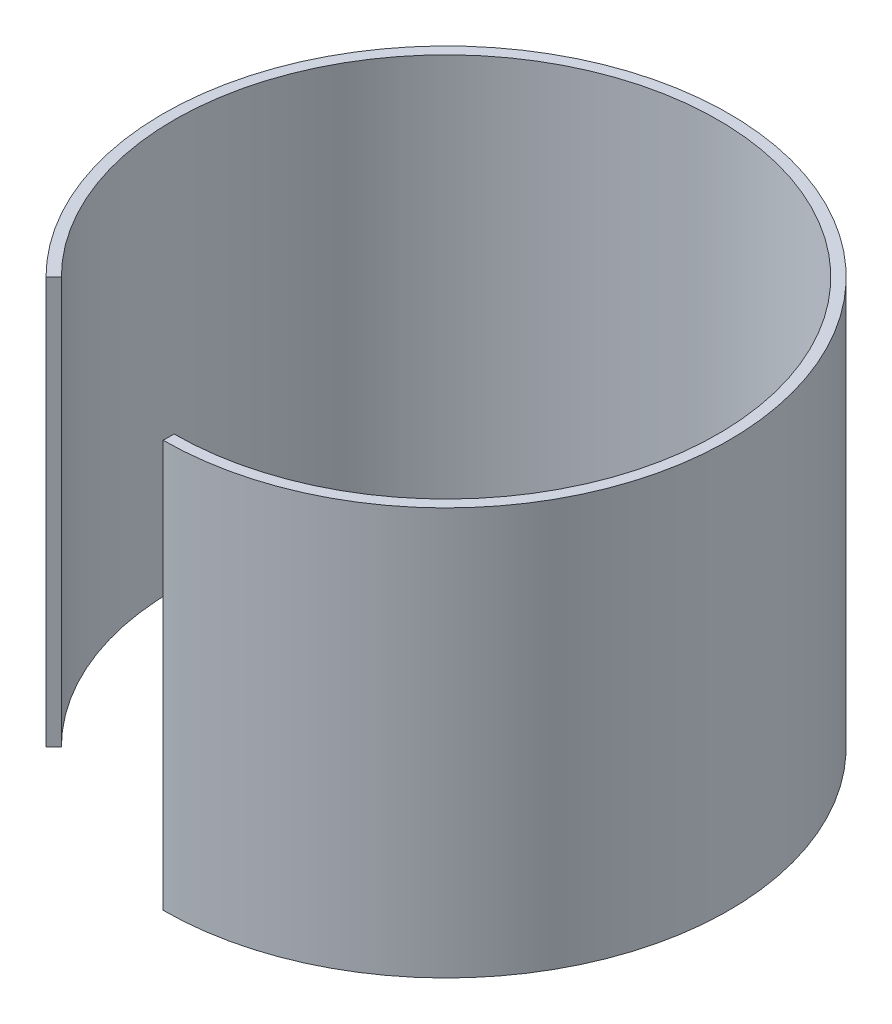
from build123d import *

# Parameters (mm, degrees)
BOSS_EXTRUDE1_DEPTH = 75


with BuildPart() as part:
    # Sketch3 → Boss-Extrude1 (new body)
    with BuildSketch(Plane(origin=(0, 0, 0), x_dir=(1, 0, 0), z_dir=(0, 1, 0))):
        with BuildLine():
            Line((0, -50.12), (0, -52.12))
            ThreePointArc((0, -52.12), (19.945460495, 48.152601234), (-36.854405435, -36.854405435))
            Line((-36.854405435, -36.854405435), (-35.440191873, -35.440191873))
            ThreePointArc((-35.440191873, -35.440191873), (19.18009363, 46.304842169), (0, -50.12))
        make_face()
    extrude(amount=BOSS_EXTRUDE1_DEPTH)


solid = part.part
